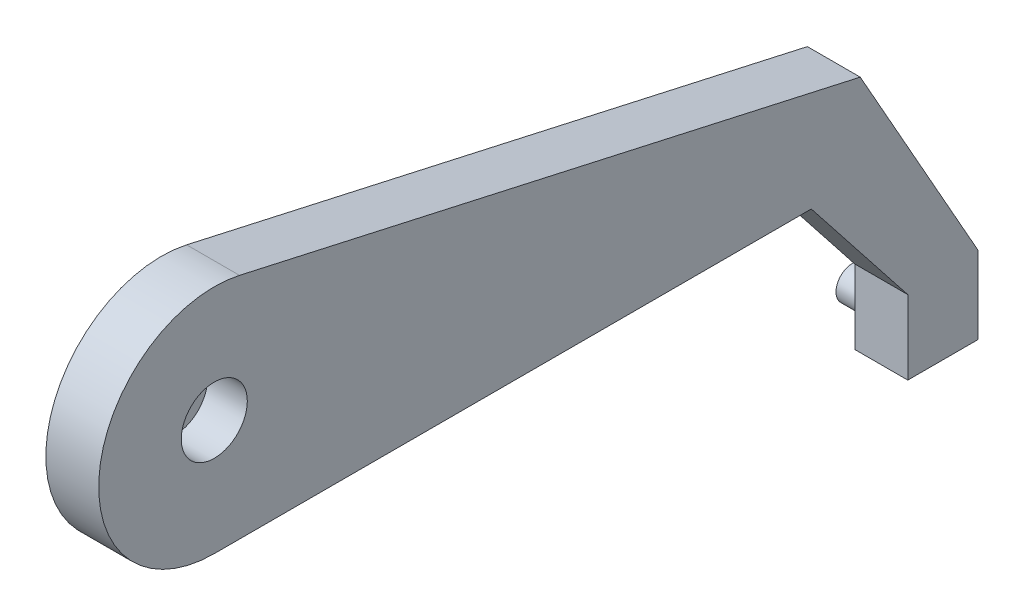
from build123d import *

# Parameters (mm, degrees)
BOSS_EXTRUDE3_DEPTH = 80
SKETCH6_R           = 50
CUT_EXTRUDE2_DEPTH  = 60
SKETCH7_R           = 25
BOSS_EXTRUDE4_DEPTH = 50


with BuildPart() as part:
    # Sketch4 → Boss-Extrude3 (new body)
    with BuildSketch(Plane(origin=(0, 0, 0), x_dir=(0, 0, -1), z_dir=(1, 0, 0))):
        with BuildLine():
            Line((1320.898617495, 319.519232733), (2260.627548778, 109.558564747))
            Line((2260.627548778, 109.558564747), (2438.924606228, -206.480811367))
            Line((2438.924606228, -206.480811367), (2438.924606228, -323.730177318))
            Line((2438.924606228, -323.730177318), (2332.658891416, -323.730177318))
            Line((2332.658891416, -323.730177318), (2332.658891416, -211.630732545))
            Line((2332.658891416, -211.630732545), (2186.534815531, -26.269822682))
            Line((2186.534815531, -26.269822682), (1282.739758098, -26.269822682))
            ThreePointArc((1282.739758098, -26.269822682), (1108.795679875, 167.925428064), (1320.898617495, 319.519232733))
        make_face()
    extrude(amount=BOSS_EXTRUDE3_DEPTH)

    # Sketch6 → Cut-Extrude2 (cut)
    with BuildSketch(Plane(origin=(80, 0, 0), x_dir=(0, 0, -1), z_dir=(1, 0, 0))):
        with Locations((1282.739758098, 148.730177318)):
            Circle(SKETCH6_R)
    extrude(amount=-CUT_EXTRUDE2_DEPTH, mode=Mode.SUBTRACT)

    # Sketch7 → Boss-Extrude4 (add)
    with BuildSketch(Plane.ZY):
        with Locations(Location((-2378.924606228, -283.730177318, 0), (0, 0, 180))):
            Circle(SKETCH7_R)
    extrude(amount=BOSS_EXTRUDE4_DEPTH)


solid = part.part
